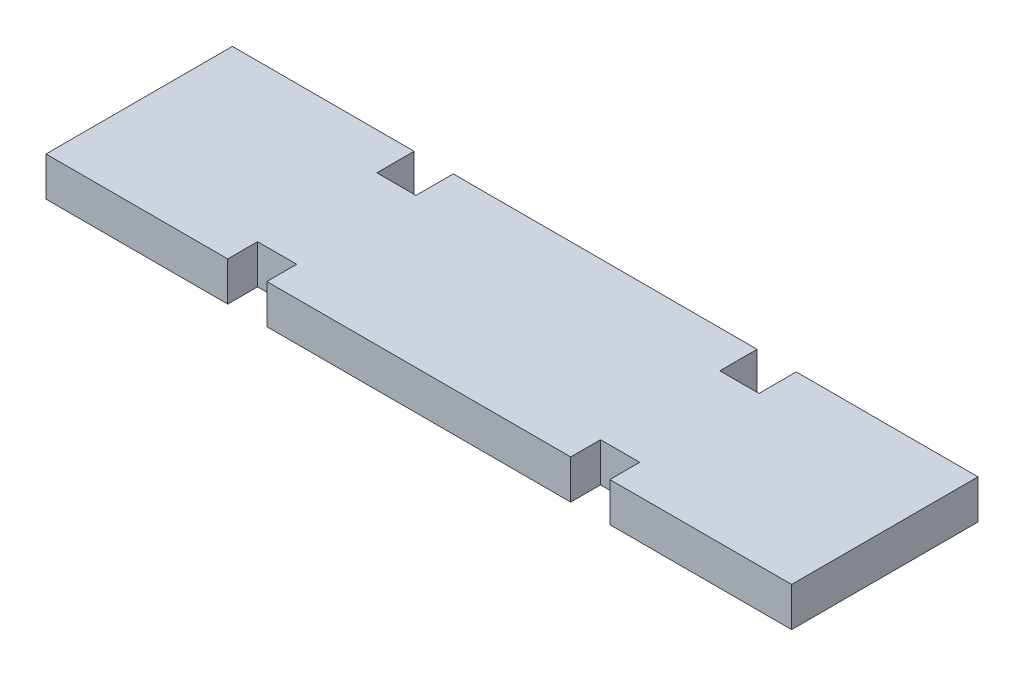
from build123d import *

# Parameters (mm, degrees)
SKETCH1_W           = 101.6
SKETCH1_H           = 25.4
BOSS_EXTRUDE1_DEPTH = 5.334
SKETCH2_W           = 5.334
SKETCH2_H           = 4.064
SKETCH2_H_2         = 5.08
CUT_EXTRUDE1_DEPTH  = 70.889176382


with BuildPart() as part:
    # Sketch1 → Boss-Extrude1 (new body)
    with BuildSketch(Plane(origin=(0, 0, 0), x_dir=(1, 0, 0), z_dir=(0, 1, 0))):
        with Locations((-10.644373227, 20.173004398)):
            Rectangle(SKETCH1_W, SKETCH1_H)
    extrude(amount=BOSS_EXTRUDE1_DEPTH)

    # Sketch2 → Cut-Extrude1 (cut, through all)
    with BuildSketch(Plane(origin=(0, 5.334, 0), x_dir=(1, 0, 0), z_dir=(0, 1, 0))):
        with Locations((-34.012373227, 9.505004398)):
            Rectangle(SKETCH2_W, SKETCH2_H)
        with Locations((12.723626773, 30.333004398)):
            Rectangle(SKETCH2_W, SKETCH2_H_2)
        with Locations((12.723626773, 9.505004398)):
            Rectangle(SKETCH2_W, SKETCH2_H)
        with Locations((-34.012373227, 30.333004398)):
            Rectangle(SKETCH2_W, SKETCH2_H_2)
    extrude(amount=-CUT_EXTRUDE1_DEPTH, mode=Mode.SUBTRACT)


solid = part.part
